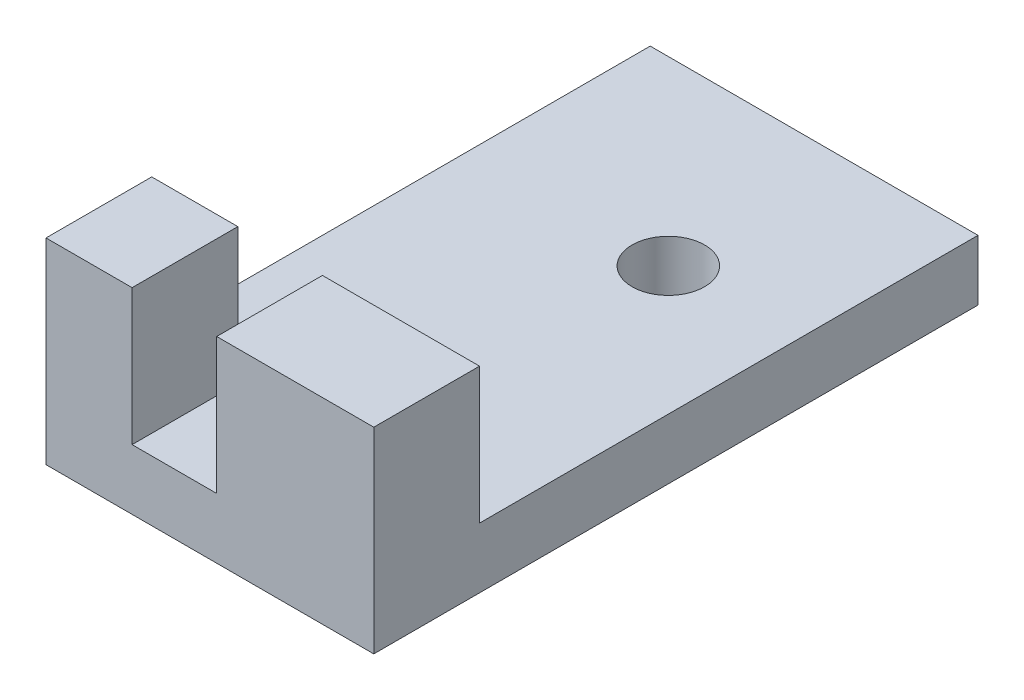
from build123d import *

# Parameters (mm, degrees)
SKETCH1_W           = 21.7
SKETCH1_H           = 40
BOSS_EXTRUDE1_DEPTH = 13
SKETCH3_W           = 21.7
SKETCH3_H           = 33
CUT_EXTRUDE1_DEPTH  = 9
SKETCH5_W           = 5.6
SKETCH5_H           = 9
CUT_EXTRUDE2_DEPTH  = 42.57992304
SKETCH6_R           = 2.4
CUT_EXTRUDE4_DEPTH  = 47.388468395


with BuildPart() as part:
    # Sketch1 → Boss-Extrude1 (new body)
    with BuildSketch(Plane(origin=(0, 0, 0), x_dir=(1, 0, 0), z_dir=(0, 1, 0))):
        with Locations((10.85, -20)):
            Rectangle(SKETCH1_W, SKETCH1_H)
    extrude(amount=BOSS_EXTRUDE1_DEPTH)

    # Sketch3 → Cut-Extrude1 (cut)
    with BuildSketch(Plane(origin=(0, 13, 0), x_dir=(1, 0, 0), z_dir=(0, 1, 0))):
        with Locations((10.85, -16.5)):
            Rectangle(SKETCH3_W, SKETCH3_H)
    extrude(amount=-CUT_EXTRUDE1_DEPTH, mode=Mode.SUBTRACT)

    # Sketch5 → Cut-Extrude2 (cut, through all)
    with BuildSketch(Plane(origin=(0, 0, 33), x_dir=(-1, 0, 0), z_dir=(0, 0, -1))):
        with Locations((-8.5, 8.5)):
            Rectangle(SKETCH5_W, SKETCH5_H)
    extrude(amount=-CUT_EXTRUDE2_DEPTH, mode=Mode.SUBTRACT)

    # Sketch6 → Cut-Extrude4 (cut, through all)
    with BuildSketch(Plane(origin=(0, 4, 0), x_dir=(1, 0, 0), z_dir=(0, 1, 0))):
        with Locations(Location((13.2, -12, 0), (0, 0, 270))):
            Circle(SKETCH6_R)
    extrude(amount=-CUT_EXTRUDE4_DEPTH, mode=Mode.SUBTRACT)


solid = part.part
